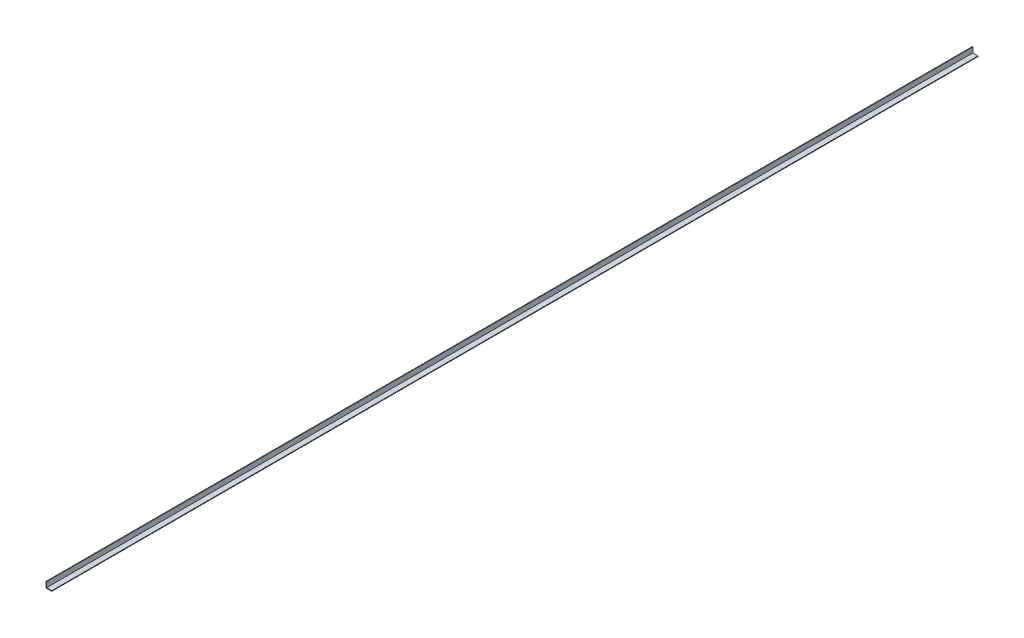
from build123d import *

# Parameters (mm, degrees)
SALIENTE_EXTRUIR1_DEPTH = 6100


with BuildPart() as part:
    # Croquis1 → Saliente-Extruir1 (new body)
    with BuildSketch(Plane.XY):
        Polygon((0, 38.1), (0, 0), (38.1, 0), (38.1, 3.96), (3.96, 3.96), (3.96, 38.1), align=None)
    extrude(amount=-SALIENTE_EXTRUIR1_DEPTH)


solid = part.part
